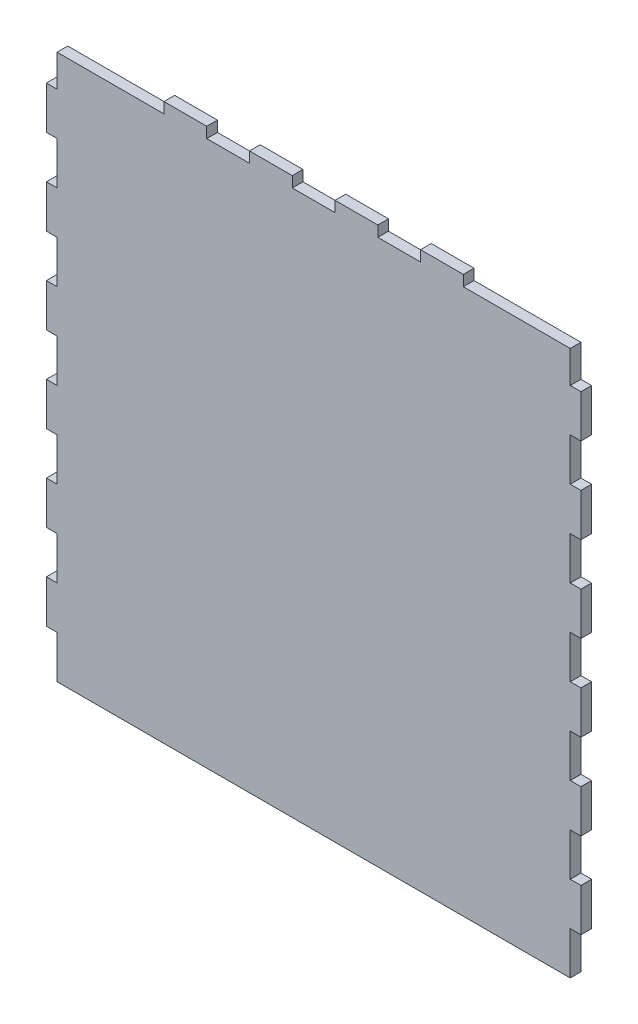
from build123d import *

# Parameters (mm, degrees)
BOSS_EXTRUDE1_DEPTH = 1.5875
SKETCH2_W           = 31.75
SKETCH2_H           = 3.175
SKETCH2_W_2         = 12.7
CUT_EXTRUDE1_DEPTH  = 3.175


with BuildPart() as part:
    # Sketch1 → Boss-Extrude1 (new, symmetric)
    with BuildSketch(Plane.XY):
        Polygon((-76.2, 82.55), (-76.2, 69.85), (-79.375, 69.85), (-79.375, 57.15), (-76.2, 57.15), (-76.2, 44.45), (-79.375, 44.45), (-79.375, 31.75), (-76.2, 31.75), (-76.2, 19.05), (-79.375, 19.05), (-79.375, 6.35), (-76.2, 6.35), (-76.2, -6.35), (-79.375, -6.35), (-79.375, -19.05), (-76.2, -19.05), (-76.2, -31.75), (-79.375, -31.75), (-79.375, -44.45), (-76.2, -44.45), (-76.2, -57.15), (-79.375, -57.15), (-79.375, -69.85), (-76.2, -69.85), (-76.2, -82.55), (76.2, -82.55), (76.2, -69.85), (79.375, -69.85), (79.375, -57.15), (76.2, -57.15), (76.2, -44.45), (79.375, -44.45), (79.375, -31.75), (76.2, -31.75), (76.2, -19.05), (79.375, -19.05), (79.375, -6.35), (76.2, -6.35), (76.2, 6.35), (79.375, 6.35), (79.375, 19.05), (76.2, 19.05), (76.2, 31.75), (79.375, 31.75), (79.375, 44.45), (76.2, 44.45), (76.2, 57.15), (79.375, 57.15), (79.375, 69.85), (76.2, 69.85), (76.2, 82.55), align=None)
    extrude(amount=BOSS_EXTRUDE1_DEPTH, both=True)

    # Sketch2 → Cut-Extrude1 (cut)
    with BuildSketch(Plane(origin=(0, 82.55, 0), x_dir=(1, 0, 0), z_dir=(0, 1, 0))):
        with Locations((60.325, 0)):
            Rectangle(SKETCH2_W, SKETCH2_H)
        with Locations((-60.325, 0)):
            Rectangle(SKETCH2_W, SKETCH2_H)
        with Locations((25.4, 0)):
            Rectangle(SKETCH2_W_2, SKETCH2_H)
        Rectangle(SKETCH2_W_2, SKETCH2_H)
        with Locations((-25.4, 0)):
            Rectangle(SKETCH2_W_2, SKETCH2_H)
    extrude(amount=-CUT_EXTRUDE1_DEPTH, mode=Mode.SUBTRACT)


solid = part.part
